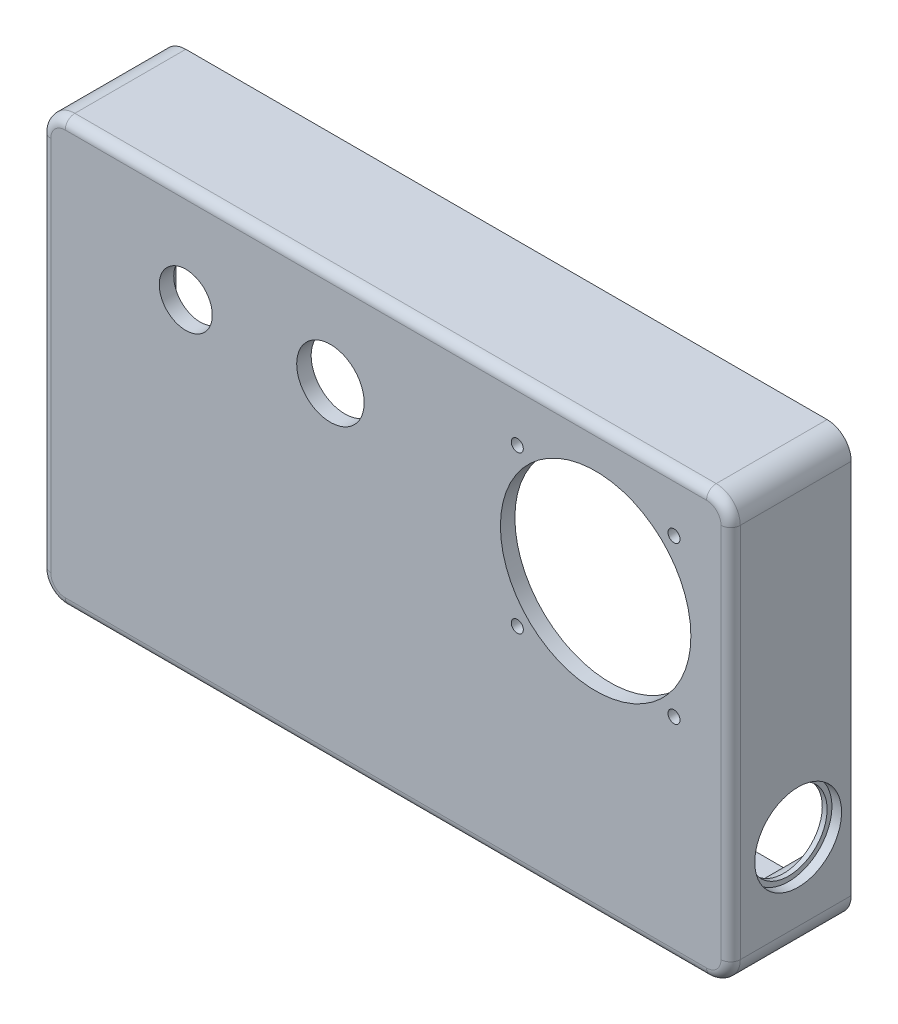
from build123d import *

# Parameters (mm, degrees)
SKETCH1_R           = 19.75
SKETCH1_R_2         = 1.25
BOSS_EXTRUDE1_DEPTH = 3
BOSS_EXTRUDE2_START = 22
SKETCH2_R           = 2
BOSS_EXTRUDE2_DEPTH = 22
SKETCH5_R           = 8
CUT_EXTRUDE1_DEPTH  = 3
SKETCH6_R           = 9
CUT_EXTRUDE2_DEPTH  = 2
FILLET2_R           = 2
SKETCH10_R          = 2.7
CUT_EXTRUDE4_DEPTH  = 4
CHAMFER1_SIZE       = 0.5
CUT_EXTRUDE5_DEPTH  = 22
SKETCH14_R          = 5.5
SKETCH14_R_2        = 7
CUT_EXTRUDE6_DEPTH  = 87.788536135


with BuildPart() as part:
    # Sketch1 → Boss-Extrude1 (new body)
    with BuildSketch(Plane.XY):
        with BuildLine():
            Line((-66.5, 44), (66.5, 44))
            ThreePointArc((66.5, 44), (70.035533906, 42.535533906), (71.5, 39))
            Line((71.5, 39), (71.5, -39))
            ThreePointArc((71.5, -39), (70.035533906, -42.535533906), (66.5, -44))
            Line((66.5, -44), (-66.5, -44))
            ThreePointArc((-66.5, -44), (-70.035533906, -42.535533906), (-71.5, -39))
            Line((-71.5, -39), (-71.5, 39))
            ThreePointArc((-71.5, 39), (-70.035533906, 42.535533906), (-66.5, 44))
        make_face()
        with Locations((43.5, 16)):
            Circle(SKETCH1_R, mode=Mode.SUBTRACT)
        with Locations((27.25, 32.25)):
            Circle(SKETCH1_R_2, mode=Mode.SUBTRACT)
        with Locations((59.75, 32.25)):
            Circle(SKETCH1_R_2, mode=Mode.SUBTRACT)
        with Locations((59.75, -0.25)):
            Circle(SKETCH1_R_2, mode=Mode.SUBTRACT)
        with Locations((27.25, -0.25)):
            Circle(SKETCH1_R_2, mode=Mode.SUBTRACT)
    extrude(amount=BOSS_EXTRUDE1_DEPTH)

    # Sketch2 → Boss-Extrude2 (add)
    with BuildSketch(Plane(origin=(0, 0, 0), x_dir=(-1, 0, 0), z_dir=(0, 0, -1)).offset(BOSS_EXTRUDE2_START)):
        with BuildLine():
            Line((-66.5, 44), (66.5, 44))
            ThreePointArc((66.5, 44), (70.035533906, 42.535533906), (71.5, 39))
            Line((71.5, 39), (71.5, -39))
            ThreePointArc((71.5, -39), (70.035533906, -42.535533906), (66.5, -44))
            Line((66.5, -44), (-66.5, -44))
            ThreePointArc((-66.5, -44), (-70.035533906, -42.535533906), (-71.5, -39))
            Line((-71.5, -39), (-71.5, 39))
            ThreePointArc((-71.5, 39), (-70.035533906, 42.535533906), (-66.5, 44))
        make_face()
        with Locations((-66.5, 39)):
            Circle(SKETCH2_R, mode=Mode.SUBTRACT)
        with Locations(Location((66.5, 39, 0), (0, 0, 180))):
            Circle(SKETCH2_R, mode=Mode.SUBTRACT)
        with Locations((66.5, -39)):
            Circle(SKETCH2_R, mode=Mode.SUBTRACT)
        with Locations(Location((-66.5, -39, 0), (0, 0, 180))):
            Circle(SKETCH2_R, mode=Mode.SUBTRACT)
        with BuildLine():
            Line((-61.917424305, 41), (61.917424305, 41))
            Line((61.917424305, 41), (61.917424305, 37))
            ThreePointArc((61.917424305, 37), (64.673843213, 34.345416088), (68.5, 34.417424305))
            Line((68.5, 34.417424305), (68.5, -34.417424305))
            ThreePointArc((68.5, -34.417424305), (64.673843213, -34.345416088), (61.917424305, -37))
            Line((61.917424305, -37), (61.917424305, -41))
            Line((61.917424305, -41), (-61.917424305, -41))
            ThreePointArc((-61.917424305, -41), (-62.964466094, -35.464466094), (-68.5, -34.417424305))
            Line((-68.5, -34.417424305), (-68.5, 34.417424305))
            ThreePointArc((-68.5, 34.417424305), (-62.964466094, 35.464466094), (-61.917424305, 41))
        make_face(mode=Mode.SUBTRACT)
    extrude(amount=-BOSS_EXTRUDE2_DEPTH)

    # Sketch5 → Cut-Extrude1 (cut)
    with BuildSketch(Plane(origin=(71.5, 0, 0), x_dir=(0, 0, -1), z_dir=(1, 0, 0))):
        with Locations(Location((11, -23, 0), (0, 0, 90))):
            Circle(SKETCH5_R)
    extrude(amount=-CUT_EXTRUDE1_DEPTH, mode=Mode.SUBTRACT)

    # Sketch6 → Cut-Extrude2 (cut)
    with BuildSketch(Plane(origin=(71.5, 0, 0), x_dir=(0, 0, -1), z_dir=(1, 0, 0))):
        with Locations(Location((11, -23, 0), (0, 0, 90))):
            Circle(SKETCH6_R)
    extrude(amount=-CUT_EXTRUDE2_DEPTH, mode=Mode.SUBTRACT)

    # Fillet2
    fillet2_edges = [part.edges().sort_by_distance(p)[0] for p in [
        (-70.035533906, -42.535533906, 3),
        (0, -44, 3),
        (70.035533906, -42.535533906, 3),
        (71.5, 0, 3),
        (70.035533906, 42.535533906, 3),
        (0, 44, 3),
        (-70.035533906, 42.535533906, 3),
        (0, 41, 0),
        (68.5, 0, 0),
        (0, -41, 0),
        (-68.5, 0, 0),
        (-71.5, 0, 3),
    ]]
    fillet(fillet2_edges, radius=FILLET2_R)

    # Sketch10 → Cut-Extrude4 (cut)
    with BuildSketch(Plane(origin=(0, 0, -22), x_dir=(-1, 0, 0), z_dir=(0, 0, -1))):
        with Locations((-66.5, 39)):
            Circle(SKETCH10_R)
        with Locations((66.5, 39)):
            Circle(SKETCH10_R)
        with Locations((66.5, -39)):
            Circle(SKETCH10_R)
        with Locations((-66.5, -39)):
            Circle(SKETCH10_R)
    extrude(amount=-CUT_EXTRUDE4_DEPTH, mode=Mode.SUBTRACT)

    # Chamfer1
    chamfer1_edges = [part.edges().sort_by_distance(p)[0] for p in [
        (69.2, -39, -22),
        (-63.8, -39, -22),
        (-63.8, 39, -22),
        (69.2, 39, -22),
    ]]
    chamfer(chamfer1_edges, length=CHAMFER1_SIZE)

    # Sketch11 → Cut-Extrude5 (cut)
    with BuildSketch(Plane(origin=(0, 0, -22), x_dir=(-1, 0, 0), z_dir=(0, 0, -1))):
        with BuildLine():
            Line((-63.75, 34.75), (-62.25, 34.75))
            Line((-62.25, 34.75), (-62.25, 36.25))
            ThreePointArc((-62.25, 36.25), (-63.310660172, 35.810660172), (-63.75, 34.75))
        make_face()
    extrude(amount=-CUT_EXTRUDE5_DEPTH, mode=Mode.SUBTRACT)

    # Sketch14 → Cut-Extrude6 (cut, through all)
    with BuildSketch(Plane(origin=(0, 0, 0), x_dir=(-1, 0, 0), z_dir=(0, 0, -1))):
        with Locations((41.5, 24)):
            Circle(SKETCH14_R)
        with Locations((11.5, 24)):
            Circle(SKETCH14_R_2)
    extrude(amount=-CUT_EXTRUDE6_DEPTH, mode=Mode.SUBTRACT)


solid = part.part
